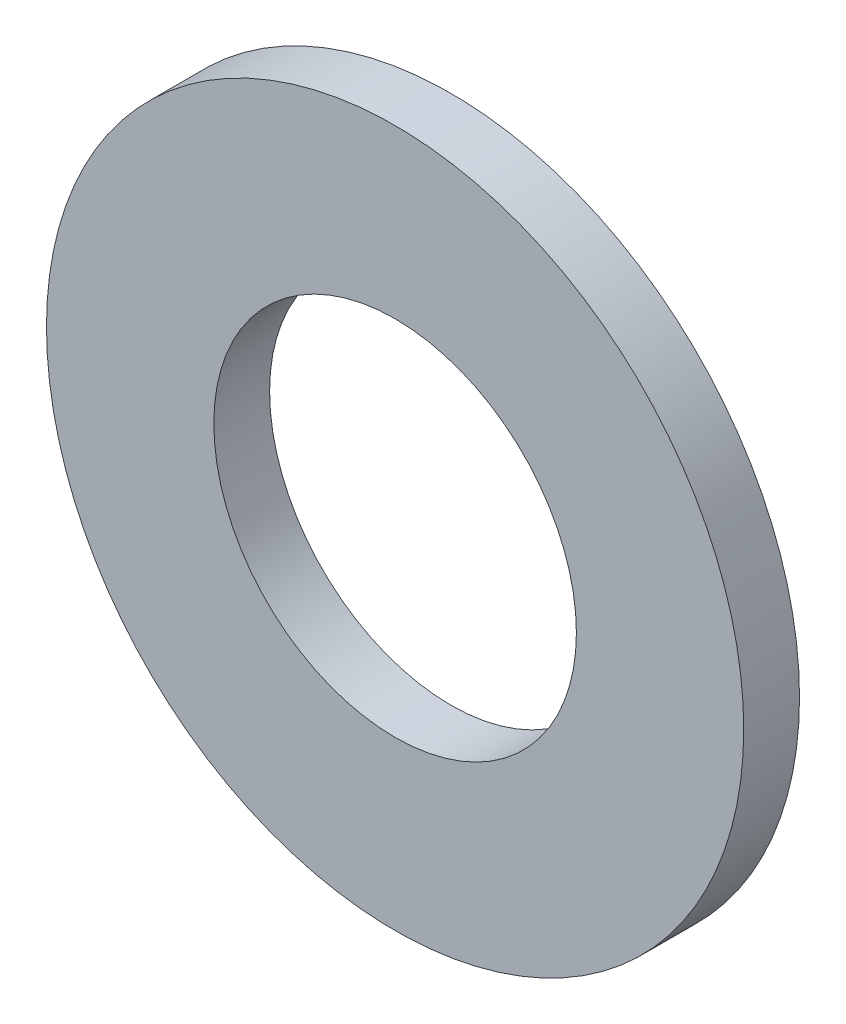
from build123d import *

# Parameters (mm, degrees)
SKETCH_1_R      = 12.5
SKETCH_1_R_2    = 6.5
EXTRUDE_1_DEPTH = 2


with BuildPart() as part:
    # 草图1 → 拉伸1 (new body)
    with BuildSketch(Plane.XY):
        Circle(SKETCH_1_R)
        Circle(SKETCH_1_R_2, mode=Mode.SUBTRACT)
    extrude(amount=EXTRUDE_1_DEPTH)


solid = part.part
